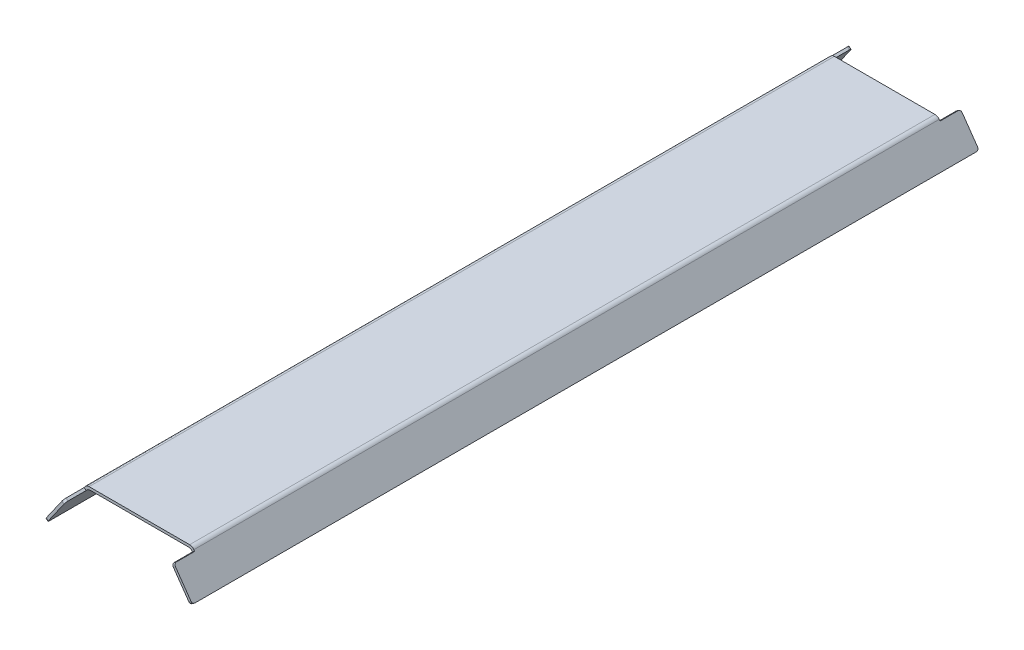
from build123d import *

# Parameters (mm, degrees)
BOSS_EXTRUDE1_DEPTH = 72
BOSS_EXTRUDE2_DEPTH = 0.25
BOSS_EXTRUDE3_DEPTH = 0.25


with BuildPart() as part:
    # Sketch2 → Boss-Extrude1 (new, symmetric)
    with BuildSketch(Plane.XY):
        with BuildLine():
            Line((13.840423978, -6.020852528), (10.273266414, -0.926423564))
            ThreePointArc((10.273266414, -0.926423564), (9.915862983, -0.612989167), (9.45411437, -0.5))
            Line((9.45411437, -0.5), (-9.45411437, -0.5))
            ThreePointArc((-9.45411437, -0.5), (-9.915862983, -0.612989167), (-10.273266414, -0.926423564))
            Line((-10.273266414, -0.926423564), (-13.840423978, -6.020852528))
            Line((-13.840423978, -6.020852528), (-14.25, -5.73406431))
            Line((-14.25, -5.73406431), (-10.533549939, -0.426423564))
            ThreePointArc((-10.533549939, -0.426423564), (-10.176146508, -0.112989167), (-9.714397895, 0))
            Line((-9.714397895, 0), (9.714397895, 0))
            ThreePointArc((9.714397895, 0), (10.176146508, -0.112989167), (10.533549939, -0.426423564))
            Line((10.533549939, -0.426423564), (14.25, -5.73406431))
            Line((14.25, -5.73406431), (13.840423978, -6.020852528))
        make_face()
    extrude(amount=BOSS_EXTRUDE1_DEPTH, both=True)

    # Sketch3 → Boss-Extrude2 (add, symmetric)
    with BuildSketch(Plane(origin=(6.662976551, 4.665466408, 0), x_dir=(0, 0, -1), z_dir=(0.8191520442889926, 0.5735764363510449, 0))):
        with BuildLine():
            Line((-72, -6.651385295), (-75.5, -6.651385295))
            ThreePointArc((-75.5, -6.651385295), (-75.853553391, -6.797831905), (-76, -7.151385295))
            Line((-76, -7.151385295), (-76, -12.37053472))
            ThreePointArc((-76, -12.37053472), (-75.853553391, -12.72408811), (-75.5, -12.87053472))
            Line((-75.5, -12.87053472), (-72, -12.87053472))
            Line((-72, -12.87053472), (-72, -6.651385295))
        make_face()
        with BuildLine():
            Line((72, -12.87053472), (72, -6.651385295))
            Line((72, -6.651385295), (75.5, -6.651385295))
            ThreePointArc((75.5, -6.651385295), (75.853553391, -6.797831905), (76, -7.151385295))
            Line((76, -7.151385295), (76, -12.37053472))
            ThreePointArc((76, -12.37053472), (75.853553391, -12.72408811), (75.5, -12.87053472))
            Line((75.5, -12.87053472), (72, -12.87053472))
        make_face()
    extrude(amount=BOSS_EXTRUDE2_DEPTH, both=True)

    # Sketch4 → Boss-Extrude3 (add, symmetric)
    with BuildSketch(Plane(origin=(-6.662976551, 4.665466408, 0), x_dir=(0, 0, 1), z_dir=(-0.819152044288993, 0.5735764363510446, 0))):
        with BuildLine():
            Line((-72, -6.651385295), (-75.5, -6.651385295))
            ThreePointArc((-75.5, -6.651385295), (-75.853553391, -6.797831905), (-76, -7.151385295))
            Line((-76, -7.151385295), (-76, -12.37053472))
            ThreePointArc((-76, -12.37053472), (-75.853553391, -12.72408811), (-75.5, -12.87053472))
            Line((-75.5, -12.87053472), (-72, -12.87053472))
            Line((-72, -12.87053472), (-72, -6.651385295))
        make_face()
        with BuildLine():
            Line((72, -12.87053472), (72, -6.651385295))
            Line((72, -6.651385295), (75.5, -6.651385295))
            ThreePointArc((75.5, -6.651385295), (75.853553391, -6.797831905), (76, -7.151385295))
            Line((76, -7.151385295), (76, -12.37053472))
            ThreePointArc((76, -12.37053472), (75.853553391, -12.72408811), (75.5, -12.87053472))
            Line((75.5, -12.87053472), (72, -12.87053472))
        make_face()
    extrude(amount=BOSS_EXTRUDE3_DEPTH, both=True)


solid = part.part
